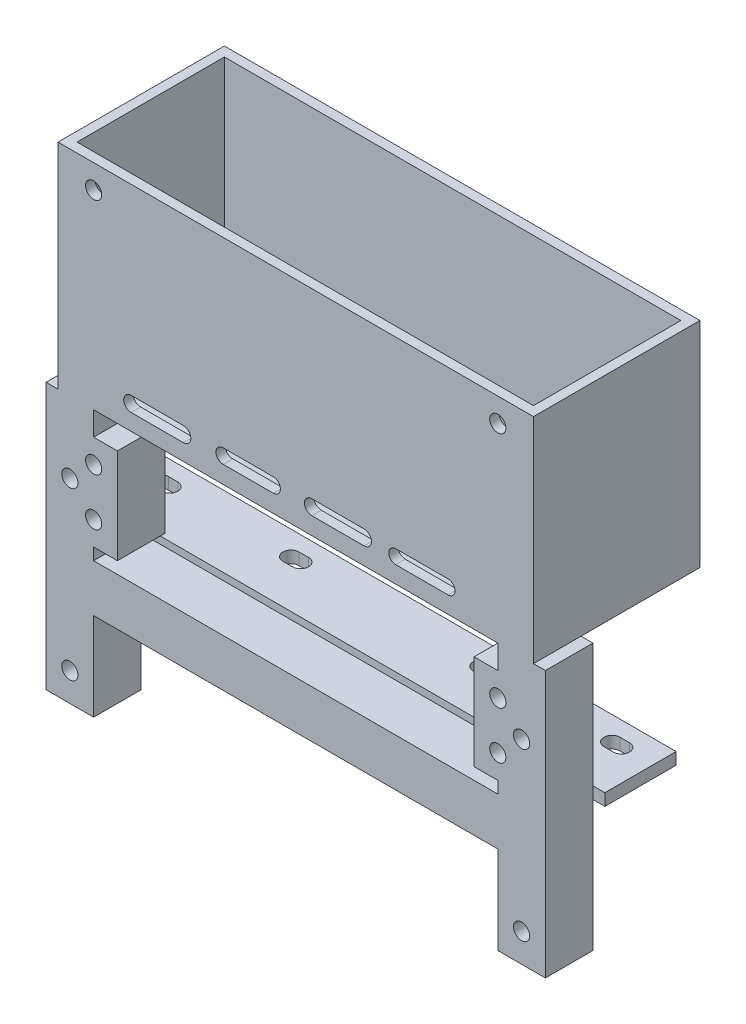
from build123d import *

# Parameters (mm, degrees)
V3_BOX_FOOTPRINT_100_X_45_MM_W                 = 100
V3_BOX_FOOTPRINT_100_X_45_MM_H                 = 45
V3_BOX_HEIGHT_35_MM_DEPTH                      = 35
V3_REAR_OPENING_96_X_31_MM_W                   = 96
V3_REAR_OPENING_96_X_31_MM_H                   = 31
V3_CAVITY_ALL_WALLS_2_MM_DEPTH                 = 43
V3_SQUARE_BEAMS_10_X_10_PITCH_95_MM_W          = 10
V3_SQUARE_BEAMS_10_X_10_PITCH_95_MM_H          = 10
V3_FORWARD_BEAM_LENGTH_65_MM_DEPTH             = 65
V3_LEFT_PCB_EAR_PROFILE_W                      = 10
V3_LEFT_PCB_EAR_PROFILE_H                      = 10
V3_LEFT_INWARD_EAR_5_MM_DEPTH                  = 5
V3_RIGHT_PCB_EAR_PROFILE_W                     = 10
V3_RIGHT_PCB_EAR_PROFILE_H                     = 10
V3_RIGHT_INWARD_EAR_5_MM_DEPTH                 = 5
V3_PCB_ROOF_PAIR_PITCH_85_MM_R                 = 1.7
V3_M3_ROOF_HOLES_DIAMETER_3_4_MM_DEPTH         = 2
V3_PCB_FORWARD_PAIR_ROW_SPACING_60_MM_R        = 1.7
V3_M3_PCB_EAR_HOLES_DEPTH                      = 10
V3_CHASSIS_TOP_HOLES_WIDTH_95_DEPTH_40_M_R     = 1.7
V3_M3_BEAM_TOP_BOTTOM_HOLES_DEPTH              = 10
V3_HANGING_PLATE_OFFSET_26_THICKNESS_2_5_W     = 110
V3_HANGING_PLATE_OFFSET_26_THICKNESS_2_5_H     = 2.5
V3_MOUNTING_PLATE_DOWNWARD_15_MM_WIDTH_1_DEPTH = 15
FOUR_HORIZONTAL_SLOTS_3_4_X_5_4_MM_DEPTH       = 2.5
CUT_EXTRUDE_1_DEPTH                            = 93.059763198
H_CROSSMEMBER_10_X_10_MM_AT_BEAM_MIDPOIN_W     = 10
H_CROSSMEMBER_10_X_10_MM_AT_BEAM_MIDPOIN_H     = 10
H_CROSSMEMBER_85_MM_DEPTH                      = 85
LONGITUDINAL_START                             = -2
BEAM_CAVITIES_6_MM_WIDE_PRESERVING_SCREW_W     = 6
BEAM_CAVITIES_6_MM_WIDE_PRESERVING_SCREW_H     = 6
BEAM_CAVITIES_6_MM_WIDE_PRESERVING_SCREW_H_2   = 27
BEAM_CAVITIES_6_MM_WIDE_PRESERVING_SCREW_H_3   = 9
LONGITUDINAL_BEAM_WALLS_2_MM_INNER_HEI_DEPTH   = 6
H_START                                        = -2
H_CROSSMEMBER_CAVITY_CONNECTS_BOTH_BEAM_W      = 89
H_CROSSMEMBER_CAVITY_CONNECTS_BOTH_BEAM_H      = 6
H_CROSSMEMBER_WALLS_2_MM_DEPTH                 = 6
CUT_EXTRUDE_4_DEPTH                            = 93.059763198
V6_EXTEND_10_X_10_HOLLOW_BEAMS_WITH_2_MM_W     = 10
V6_EXTEND_10_X_10_HOLLOW_BEAMS_WITH_2_MM_H     = 10
V6_EXTEND_10_X_10_HOLLOW_BEAMS_WITH_2_MM_W_2   = 6
V6_EXTEND_10_X_10_HOLLOW_BEAMS_WITH_2_MM_H_2   = 6
V6_HOLLOW_BEAM_EXTENSIONS_15_MM_DEPTH          = 15
V6_FOUR_FULL_DEPTH_PCB_PADS_CENTERS_X42_W      = 15
V6_FOUR_FULL_DEPTH_PCB_PADS_CENTERS_X42_H      = 10
V6_SOLID_SCREW_PADS_WITH_5_MM_INWARD_EAR_DEPTH = 10
V6_PCB_HOLES_85_X_60_MM_AND_RETAINED_CHA_R     = 1.7
V6_FOUR_PCB_M3_HOLES_THROUGH_REINFORCED_DEPTH  = 10
V7_RETAIN_RAIL_ENVELOPES_10_X_10_LENGTH_W      = 10
V7_RETAIN_RAIL_ENVELOPES_10_X_10_LENGTH_H      = 80
V7_SOLID_LONGITUDINAL_BEAMS_DEPTH              = 10
V7_RETAIN_H_CROSSMEMBER_ENVELOPE_W             = 85
V7_RETAIN_H_CROSSMEMBER_ENVELOPE_H             = 10
V7_SOLID_H_CROSSMEMBER_DEPTH                   = 10
V7_PRESERVE_ALL_TEN_EXISTING_BEAM_M3_BOR_R     = 1.7
V7_RESTORE_CHASSIS_AND_PCB_CLEARANCE_BOR_DEPTH = 10
V7_REFILL_OLD_MOUNTING_SLOTS_WITHIN_UNCH_W     = 110
V7_REFILL_OLD_MOUNTING_SLOTS_WITHIN_UNCH_H     = 15
V7_CLOSE_PREVIOUS_SLOT_POSITIONS_DEPTH         = 2.5
V7_FOUR_HORIZONTAL_SLOTS_3_4_X_5_4_MM_AT_DEPTH = 2.5
V8_REFILL_OLD_CHASSIS_BORE_ROW_Y_55_BEFO_W     = 4
V8_REFILL_OLD_CHASSIS_BORE_ROW_Y_55_BEFO_H     = 4
V8_CLOSE_CHASSIS_HOLES_THAT_WOULD_BREAK_DEPTH  = 10
V8_SHORTEN_BOTH_FREE_ENDS_BY_24_MM_W           = 110
V8_SHORTEN_BOTH_FREE_ENDS_BY_24_MM_H           = 10
V8_SOLID_BEAMS_LENGTH_56_MM_PRESERVE_PLA_DEPTH = 24
V8_CHASSIS_PAIR_Y_50_WITH_6_MM_END_DISTA_R     = 1.7
V8_CHASSIS_M3_HOLES_MOVED_5_MM_TOWARD_BA_DEPTH = 10


with BuildPart() as part:
    # V3 box footprint 100 x 45 mm → V3 box height 35 mm (new body)
    with BuildSketch(Plane.XY):
        with Locations((0, 22.5)):
            Rectangle(V3_BOX_FOOTPRINT_100_X_45_MM_W, V3_BOX_FOOTPRINT_100_X_45_MM_H)
    extrude(amount=V3_BOX_HEIGHT_35_MM_DEPTH)

    # V3 rear opening 96 x 31 mm → V3 cavity all walls 2 mm (cut)
    with BuildSketch(Plane(origin=(0, 45, 0), x_dir=(1, 0, 0), z_dir=(0, 1, 0))):
        with Locations((0, -17.5)):
            Rectangle(V3_REAR_OPENING_96_X_31_MM_W, V3_REAR_OPENING_96_X_31_MM_H)
    extrude(amount=-V3_CAVITY_ALL_WALLS_2_MM_DEPTH, mode=Mode.SUBTRACT)

    # V3 square beams 10 x 10 pitch 95 mm → V3 forward beam length 65 mm (add)
    with BuildSketch(Plane.XZ):
        with Locations((-47.5, 30)):
            Rectangle(V3_SQUARE_BEAMS_10_X_10_PITCH_95_MM_W, V3_SQUARE_BEAMS_10_X_10_PITCH_95_MM_H)
        with Locations((47.5, 30)):
            Rectangle(V3_SQUARE_BEAMS_10_X_10_PITCH_95_MM_W, V3_SQUARE_BEAMS_10_X_10_PITCH_95_MM_H)
    extrude(amount=V3_FORWARD_BEAM_LENGTH_65_MM_DEPTH)

    # V3 left PCB ear profile → V3 left inward ear 5 mm (add)
    with BuildSketch(Plane(origin=(-42.5, 0, 0), x_dir=(0, 0, -1), z_dir=(1, 0, 0))):
        with Locations((-30, -20)):
            Rectangle(V3_LEFT_PCB_EAR_PROFILE_W, V3_LEFT_PCB_EAR_PROFILE_H)
    extrude(amount=V3_LEFT_INWARD_EAR_5_MM_DEPTH)

    # V3 right PCB ear profile → V3 right inward ear 5 mm (add)
    with BuildSketch(Plane.ZY.offset(-42.5)):
        with Locations((30, -20)):
            Rectangle(V3_RIGHT_PCB_EAR_PROFILE_W, V3_RIGHT_PCB_EAR_PROFILE_H)
    extrude(amount=V3_RIGHT_INWARD_EAR_5_MM_DEPTH)

    # V3 PCB roof pair pitch 85 mm → V3 M3 roof holes diameter 3.4 mm (cut)
    with BuildSketch(Plane.XY.offset(35)):
        with Locations((-42.5, 40)):
            Circle(V3_PCB_ROOF_PAIR_PITCH_85_MM_R)
        with Locations((42.5, 40)):
            Circle(V3_PCB_ROOF_PAIR_PITCH_85_MM_R)
    extrude(amount=-V3_M3_ROOF_HOLES_DIAMETER_3_4_MM_DEPTH, mode=Mode.SUBTRACT)

    # V3 PCB forward pair row spacing 60 mm → V3 M3 PCB ear holes (cut)
    with BuildSketch(Plane.XY.offset(35)):
        with Locations((-42.5, -20)):
            Circle(V3_PCB_FORWARD_PAIR_ROW_SPACING_60_MM_R)
        with Locations((42.5, -20)):
            Circle(V3_PCB_FORWARD_PAIR_ROW_SPACING_60_MM_R)
    extrude(amount=-V3_M3_PCB_EAR_HOLES_DEPTH, mode=Mode.SUBTRACT)

    # V3 chassis top holes width 95 depth 40 mm → V3 M3 beam top bottom holes (cut)
    with BuildSketch(Plane.XY.offset(35)):
        with Locations((-47.5, -55)):
            Circle(V3_CHASSIS_TOP_HOLES_WIDTH_95_DEPTH_40_M_R)
        with Locations((-47.5, -15)):
            Circle(V3_CHASSIS_TOP_HOLES_WIDTH_95_DEPTH_40_M_R)
        with Locations((47.5, -55)):
            Circle(V3_CHASSIS_TOP_HOLES_WIDTH_95_DEPTH_40_M_R)
        with Locations((47.5, -15)):
            Circle(V3_CHASSIS_TOP_HOLES_WIDTH_95_DEPTH_40_M_R)
    extrude(amount=-V3_M3_BEAM_TOP_BOTTOM_HOLES_DEPTH, mode=Mode.SUBTRACT)

    # V3 hanging plate offset 26 thickness 2.5 mm → V3 mounting plate downward 15 mm width 110 (add)
    with BuildSketch(Plane(origin=(0, 0, 25), x_dir=(-1, 0, 0), z_dir=(0, 0, -1))):
        with Locations((0, -27.25)):
            Rectangle(V3_HANGING_PLATE_OFFSET_26_THICKNESS_2_5_W, V3_HANGING_PLATE_OFFSET_26_THICKNESS_2_5_H)
    extrude(amount=V3_MOUNTING_PLATE_DOWNWARD_15_MM_WIDTH_1_DEPTH)

    # V3 slots 6 mm below beam underside centers 20 and 47.5 → Four horizontal slots 3.4 x 5.4 mm (cut)
    with BuildSketch(Plane.XZ.offset(28.5)):
        with BuildLine():
            Line((-48.5, 20.7), (-46.5, 20.7))
            ThreePointArc((-46.5, 20.7), (-44.8, 19), (-46.5, 17.3))
            Line((-46.5, 17.3), (-48.5, 17.3))
            ThreePointArc((-48.5, 17.3), (-50.2, 19), (-48.5, 20.7))
        make_face()
        with BuildLine():
            Line((-21, 20.7), (-19, 20.7))
            ThreePointArc((-19, 20.7), (-17.3, 19), (-19, 17.3))
            Line((-19, 17.3), (-21, 17.3))
            ThreePointArc((-21, 17.3), (-22.7, 19), (-21, 20.7))
        make_face()
        with BuildLine():
            Line((19, 20.7), (21, 20.7))
            ThreePointArc((21, 20.7), (22.7, 19), (21, 17.3))
            Line((21, 17.3), (19, 17.3))
            ThreePointArc((19, 17.3), (17.3, 19), (19, 20.7))
        make_face()
        with BuildLine():
            Line((46.5, 20.7), (48.5, 20.7))
            ThreePointArc((48.5, 20.7), (50.2, 19), (48.5, 17.3))
            Line((48.5, 17.3), (46.5, 17.3))
            ThreePointArc((46.5, 17.3), (44.8, 19), (46.5, 20.7))
        make_face()
    extrude(amount=-FOUR_HORIZONTAL_SLOTS_3_4_X_5_4_MM_DEPTH, mode=Mode.SUBTRACT)

    # 草图2 → 切除-拉伸1 (cut, through all)
    with BuildSketch(Plane(origin=(0, 0, 0), x_dir=(-1, 0, 0), z_dir=(0, 0, -1))):
        with BuildLine():
            Line((-32.029979042, 6.459471041), (-21.029979042, 6.459471041))
            ThreePointArc((-21.029979042, 6.459471041), (-19.570508001, 5), (-21.029979042, 3.540528959))
            Line((-21.029979042, 3.540528959), (-32.029979042, 3.540528959))
            ThreePointArc((-32.029979042, 3.540528959), (-33.489450083, 5), (-32.029979042, 6.459471041))
        make_face()
        with BuildLine():
            Line((23.620107008, 6.558669056), (34.620107008, 6.558669056))
            ThreePointArc((34.620107008, 6.558669056), (36.178776063, 5), (34.620107008, 3.441330944))
            Line((34.620107008, 3.441330944), (23.620107008, 3.441330944))
            ThreePointArc((23.620107008, 3.441330944), (22.061437952, 5), (23.620107008, 6.558669056))
        make_face()
    extrude(amount=-CUT_EXTRUDE_1_DEPTH, mode=Mode.SUBTRACT)

    # H crossmember 10 x 10 mm at beam midpoint → H crossmember 85 mm (add)
    with BuildSketch(Plane(origin=(-42.5, 0, 0), x_dir=(0, 0, -1), z_dir=(1, 0, 0))):
        with Locations((-30, -32.5)):
            Rectangle(H_CROSSMEMBER_10_X_10_MM_AT_BEAM_MIDPOIN_W, H_CROSSMEMBER_10_X_10_MM_AT_BEAM_MIDPOIN_H)
    extrude(amount=H_CROSSMEMBER_85_MM_DEPTH)

    # Beam cavities 6 mm wide preserving screw collars → Longitudinal beam walls 2 mm - inner height 6 mm (cut)
    with BuildSketch(Plane.XY.offset(35).offset(LONGITUDINAL_START)):
        with Locations((-47.5, -62)):
            Rectangle(BEAM_CAVITIES_6_MM_WIDE_PRESERVING_SCREW_W, BEAM_CAVITIES_6_MM_WIDE_PRESERVING_SCREW_H)
        with Locations((-47.5, -37.5)):
            Rectangle(BEAM_CAVITIES_6_MM_WIDE_PRESERVING_SCREW_W, BEAM_CAVITIES_6_MM_WIDE_PRESERVING_SCREW_H_2)
        with Locations((-47.5, -6.5)):
            Rectangle(BEAM_CAVITIES_6_MM_WIDE_PRESERVING_SCREW_W, BEAM_CAVITIES_6_MM_WIDE_PRESERVING_SCREW_H_3)
        with Locations((47.5, -62)):
            Rectangle(BEAM_CAVITIES_6_MM_WIDE_PRESERVING_SCREW_W, BEAM_CAVITIES_6_MM_WIDE_PRESERVING_SCREW_H)
        with Locations((47.5, -37.5)):
            Rectangle(BEAM_CAVITIES_6_MM_WIDE_PRESERVING_SCREW_W, BEAM_CAVITIES_6_MM_WIDE_PRESERVING_SCREW_H_2)
        with Locations((47.5, -6.5)):
            Rectangle(BEAM_CAVITIES_6_MM_WIDE_PRESERVING_SCREW_W, BEAM_CAVITIES_6_MM_WIDE_PRESERVING_SCREW_H_3)
    extrude(amount=-LONGITUDINAL_BEAM_WALLS_2_MM_INNER_HEI_DEPTH, mode=Mode.SUBTRACT)

    # H crossmember cavity connects both beam cavities → H crossmember walls 2 mm (cut)
    with BuildSketch(Plane.XY.offset(35).offset(H_START)):
        with Locations((0, -32.5)):
            Rectangle(H_CROSSMEMBER_CAVITY_CONNECTS_BOTH_BEAM_W, H_CROSSMEMBER_CAVITY_CONNECTS_BOTH_BEAM_H)
    extrude(amount=-H_CROSSMEMBER_WALLS_2_MM_DEPTH, mode=Mode.SUBTRACT)

    # 草图8 → 切除-拉伸4 (cut, through all)
    with BuildSketch(Plane(origin=(0, 0, 0), x_dir=(-1, 0, 0), z_dir=(0, 0, -1))):
        with BuildLine():
            Line((-14.372732488, 6.733005515), (-3.372732488, 6.733005515))
            ThreePointArc((-3.372732488, 6.733005515), (-1.826093217, 5.186366244), (-3.372732488, 3.639726973))
            Line((-3.372732488, 3.639726973), (-14.372732488, 3.639726973))
            ThreePointArc((-14.372732488, 3.639726973), (-15.919371759, 5.186366244), (-14.372732488, 6.733005515))
        make_face()
        with BuildLine():
            Line((4.72350579, 6.686366244), (15.27649421, 6.686366244))
            ThreePointArc((15.27649421, 6.686366244), (16.77649421, 5.186366244), (15.27649421, 3.686366244))
            Line((15.27649421, 3.686366244), (4.72350579, 3.686366244))
            ThreePointArc((4.72350579, 3.686366244), (3.22350579, 5.186366244), (4.72350579, 6.686366244))
        make_face()
    extrude(amount=-CUT_EXTRUDE_4_DEPTH, mode=Mode.SUBTRACT)

    # V6 extend 10 x 10 hollow beams with 2 mm walls → V6 hollow beam extensions 15 mm (add)
    # profile 1 of 2: a face of its own
    with BuildSketch(Plane.XZ.offset(65)):
        with Locations((-47.5, 30)):
            Rectangle(V6_EXTEND_10_X_10_HOLLOW_BEAMS_WITH_2_MM_W, V6_EXTEND_10_X_10_HOLLOW_BEAMS_WITH_2_MM_H)
        with Locations((-47.5, 30)):
            Rectangle(V6_EXTEND_10_X_10_HOLLOW_BEAMS_WITH_2_MM_W_2, V6_EXTEND_10_X_10_HOLLOW_BEAMS_WITH_2_MM_H_2, mode=Mode.SUBTRACT)
    # profile 2 of 2: a face of its own
    with BuildSketch(Plane.XZ.offset(65)):
        with Locations((47.5, 30)):
            Rectangle(V6_EXTEND_10_X_10_HOLLOW_BEAMS_WITH_2_MM_W, V6_EXTEND_10_X_10_HOLLOW_BEAMS_WITH_2_MM_H)
        with Locations((47.5, 30)):
            Rectangle(V6_EXTEND_10_X_10_HOLLOW_BEAMS_WITH_2_MM_W_2, V6_EXTEND_10_X_10_HOLLOW_BEAMS_WITH_2_MM_H_2, mode=Mode.SUBTRACT)
    extrude(amount=V6_HOLLOW_BEAM_EXTENSIONS_15_MM_DEPTH)

    # V6 four full-depth PCB pads centers x42.5 y-70 and -10 → V6 solid screw pads with 5 mm inward ears (add)
    with BuildSketch(Plane.XY.offset(35)):
        with Locations((-45, -70)):
            Rectangle(V6_FOUR_FULL_DEPTH_PCB_PADS_CENTERS_X42_W, V6_FOUR_FULL_DEPTH_PCB_PADS_CENTERS_X42_H)
        with Locations((45, -70)):
            Rectangle(V6_FOUR_FULL_DEPTH_PCB_PADS_CENTERS_X42_W, V6_FOUR_FULL_DEPTH_PCB_PADS_CENTERS_X42_H)
        with Locations((-45, -10)):
            Rectangle(V6_FOUR_FULL_DEPTH_PCB_PADS_CENTERS_X42_W, V6_FOUR_FULL_DEPTH_PCB_PADS_CENTERS_X42_H)
        with Locations((45, -10)):
            Rectangle(V6_FOUR_FULL_DEPTH_PCB_PADS_CENTERS_X42_W, V6_FOUR_FULL_DEPTH_PCB_PADS_CENTERS_X42_H)
    extrude(amount=-V6_SOLID_SCREW_PADS_WITH_5_MM_INWARD_EAR_DEPTH)

    # V6 PCB holes 85 x 60 mm and retained chassis holes → V6 four PCB M3 holes through reinforced beam pads (cut)
    with BuildSketch(Plane.XY.offset(35)):
        with Locations((-42.5, -70)):
            Circle(V6_PCB_HOLES_85_X_60_MM_AND_RETAINED_CHA_R)
        with Locations((-42.5, -10)):
            Circle(V6_PCB_HOLES_85_X_60_MM_AND_RETAINED_CHA_R)
        with Locations((42.5, -70)):
            Circle(V6_PCB_HOLES_85_X_60_MM_AND_RETAINED_CHA_R)
        with Locations((42.5, -10)):
            Circle(V6_PCB_HOLES_85_X_60_MM_AND_RETAINED_CHA_R)
        with Locations((-47.5, -15)):
            Circle(V6_PCB_HOLES_85_X_60_MM_AND_RETAINED_CHA_R)
        with Locations((47.5, -15)):
            Circle(V6_PCB_HOLES_85_X_60_MM_AND_RETAINED_CHA_R)
    extrude(amount=-V6_FOUR_PCB_M3_HOLES_THROUGH_REINFORCED_DEPTH, mode=Mode.SUBTRACT)

    # V7 retain rail envelopes 10 x 10 length 80 mm → V7 solid longitudinal beams (add)
    with BuildSketch(Plane.XY.offset(35)):
        with Locations((-47.5, -40)):
            Rectangle(V7_RETAIN_RAIL_ENVELOPES_10_X_10_LENGTH_W, V7_RETAIN_RAIL_ENVELOPES_10_X_10_LENGTH_H)
        with Locations((47.5, -40)):
            Rectangle(V7_RETAIN_RAIL_ENVELOPES_10_X_10_LENGTH_W, V7_RETAIN_RAIL_ENVELOPES_10_X_10_LENGTH_H)
    extrude(amount=-V7_SOLID_LONGITUDINAL_BEAMS_DEPTH)

    # V7 retain H crossmember envelope → V7 solid H crossmember (add)
    with BuildSketch(Plane.XY.offset(35)):
        with Locations((0, -32.5)):
            Rectangle(V7_RETAIN_H_CROSSMEMBER_ENVELOPE_W, V7_RETAIN_H_CROSSMEMBER_ENVELOPE_H)
    extrude(amount=-V7_SOLID_H_CROSSMEMBER_DEPTH)

    # V7 preserve all ten existing beam M3 bores → V7 restore chassis and PCB clearance bores (cut)
    with BuildSketch(Plane.XY.offset(35)):
        with Locations((-47.5, -55)):
            Circle(V7_PRESERVE_ALL_TEN_EXISTING_BEAM_M3_BOR_R)
        with Locations((-47.5, -15)):
            Circle(V7_PRESERVE_ALL_TEN_EXISTING_BEAM_M3_BOR_R)
        with Locations((47.5, -55)):
            Circle(V7_PRESERVE_ALL_TEN_EXISTING_BEAM_M3_BOR_R)
        with Locations((47.5, -15)):
            Circle(V7_PRESERVE_ALL_TEN_EXISTING_BEAM_M3_BOR_R)
        with Locations((-42.5, -70)):
            Circle(V7_PRESERVE_ALL_TEN_EXISTING_BEAM_M3_BOR_R)
        with Locations((-42.5, -20)):
            Circle(V7_PRESERVE_ALL_TEN_EXISTING_BEAM_M3_BOR_R)
        with Locations((-42.5, -10)):
            Circle(V7_PRESERVE_ALL_TEN_EXISTING_BEAM_M3_BOR_R)
        with Locations((42.5, -70)):
            Circle(V7_PRESERVE_ALL_TEN_EXISTING_BEAM_M3_BOR_R)
        with Locations((42.5, -20)):
            Circle(V7_PRESERVE_ALL_TEN_EXISTING_BEAM_M3_BOR_R)
        with Locations((42.5, -10)):
            Circle(V7_PRESERVE_ALL_TEN_EXISTING_BEAM_M3_BOR_R)
    extrude(amount=-V7_RESTORE_CHASSIS_AND_PCB_CLEARANCE_BOR_DEPTH, mode=Mode.SUBTRACT)

    # V7 refill old mounting slots within unchanged plate → V7 close previous slot positions (add)
    with BuildSketch(Plane.XZ.offset(28.5)):
        with Locations((0, 17.5)):
            Rectangle(V7_REFILL_OLD_MOUNTING_SLOTS_WITHIN_UNCH_W, V7_REFILL_OLD_MOUNTING_SLOTS_WITHIN_UNCH_H)
    extrude(amount=-V7_CLOSE_PREVIOUS_SLOT_POSITIONS_DEPTH)

    # V7 slot centers z15 - 10 mm below beam underside z25 → V7 four horizontal slots 3.4 x 5.4 mm at 10 mm (cut)
    with BuildSketch(Plane.XZ.offset(28.5)):
        with BuildLine():
            Line((-48.5, 16.7), (-46.5, 16.7))
            ThreePointArc((-46.5, 16.7), (-44.8, 15), (-46.5, 13.3))
            Line((-46.5, 13.3), (-48.5, 13.3))
            ThreePointArc((-48.5, 13.3), (-50.2, 15), (-48.5, 16.7))
        make_face()
        with BuildLine():
            Line((-21, 16.7), (-19, 16.7))
            ThreePointArc((-19, 16.7), (-17.3, 15), (-19, 13.3))
            Line((-19, 13.3), (-21, 13.3))
            ThreePointArc((-21, 13.3), (-22.7, 15), (-21, 16.7))
        make_face()
        with BuildLine():
            Line((19, 16.7), (21, 16.7))
            ThreePointArc((21, 16.7), (22.7, 15), (21, 13.3))
            Line((21, 13.3), (19, 13.3))
            ThreePointArc((19, 13.3), (17.3, 15), (19, 16.7))
        make_face()
        with BuildLine():
            Line((46.5, 16.7), (48.5, 16.7))
            ThreePointArc((48.5, 16.7), (50.2, 15), (48.5, 13.3))
            Line((48.5, 13.3), (46.5, 13.3))
            ThreePointArc((46.5, 13.3), (44.8, 15), (46.5, 16.7))
        make_face()
    extrude(amount=-V7_FOUR_HORIZONTAL_SLOTS_3_4_X_5_4_MM_AT_DEPTH, mode=Mode.SUBTRACT)

    # V8 refill old chassis bore row y-55 before shortening → V8 close chassis holes that would break beam ends (add)
    with BuildSketch(Plane.XY.offset(35)):
        with Locations((-47.5, -55)):
            Rectangle(V8_REFILL_OLD_CHASSIS_BORE_ROW_Y_55_BEFO_W, V8_REFILL_OLD_CHASSIS_BORE_ROW_Y_55_BEFO_H)
        with Locations((47.5, -55)):
            Rectangle(V8_REFILL_OLD_CHASSIS_BORE_ROW_Y_55_BEFO_W, V8_REFILL_OLD_CHASSIS_BORE_ROW_Y_55_BEFO_H)
    extrude(amount=-V8_CLOSE_CHASSIS_HOLES_THAT_WOULD_BREAK_DEPTH)

    # V8 shorten both free ends by 24 mm → V8 solid beams length 56 mm preserve plate position (cut)
    with BuildSketch(Plane.XZ.offset(80)):
        with Locations((0, 30)):
            Rectangle(V8_SHORTEN_BOTH_FREE_ENDS_BY_24_MM_W, V8_SHORTEN_BOTH_FREE_ENDS_BY_24_MM_H)
    extrude(amount=-V8_SOLID_BEAMS_LENGTH_56_MM_PRESERVE_PLA_DEPTH, mode=Mode.SUBTRACT)

    # V8 chassis pair y-50 with 6 mm end distance → V8 chassis M3 holes moved 5 mm toward battery box (cut)
    with BuildSketch(Plane.XY.offset(35)):
        with Locations((-47.5, -50)):
            Circle(V8_CHASSIS_PAIR_Y_50_WITH_6_MM_END_DISTA_R)
        with Locations((47.5, -50)):
            Circle(V8_CHASSIS_PAIR_Y_50_WITH_6_MM_END_DISTA_R)
    extrude(amount=-V8_CHASSIS_M3_HOLES_MOVED_5_MM_TOWARD_BA_DEPTH, mode=Mode.SUBTRACT)


solid = part.part
